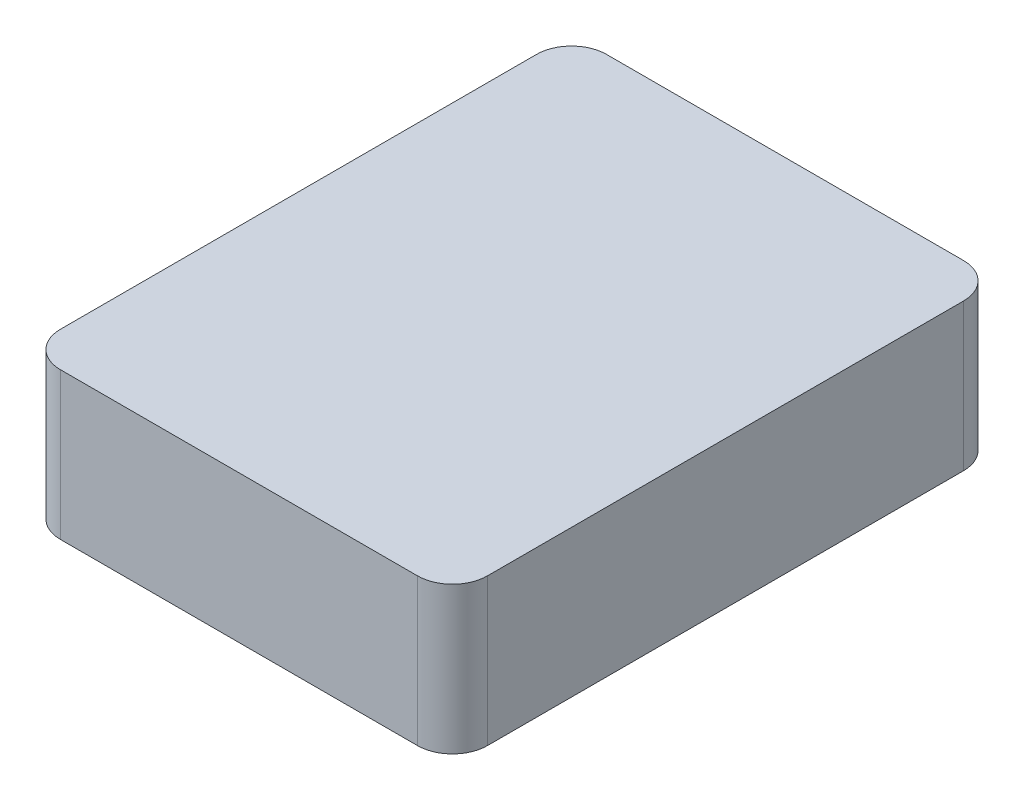
from build123d import *

# Parameters (mm, degrees)
SKETCH1_W           = 61
SKETCH1_H           = 78
BOSS_EXTRUDE1_DEPTH = 21
FILLET1_R           = 5


with BuildPart() as part:
    # Sketch1 → Boss-Extrude1 (new body)
    with BuildSketch(Plane(origin=(0, 0, 0), x_dir=(1, 0, 0), z_dir=(0, 1, 0))):
        with Locations((30.5, 39)):
            Rectangle(SKETCH1_W, SKETCH1_H)
    extrude(amount=BOSS_EXTRUDE1_DEPTH)

    # Fillet1
    fillet1_edges = [part.edges().sort_by_distance(p)[0] for p in [
        (0, 10.5, -78),
        (61, 10.5, -78),
        (61, 10.5, 0),
        (0, 10.5, 0),
    ]]
    fillet(fillet1_edges, radius=FILLET1_R)


solid = part.part
